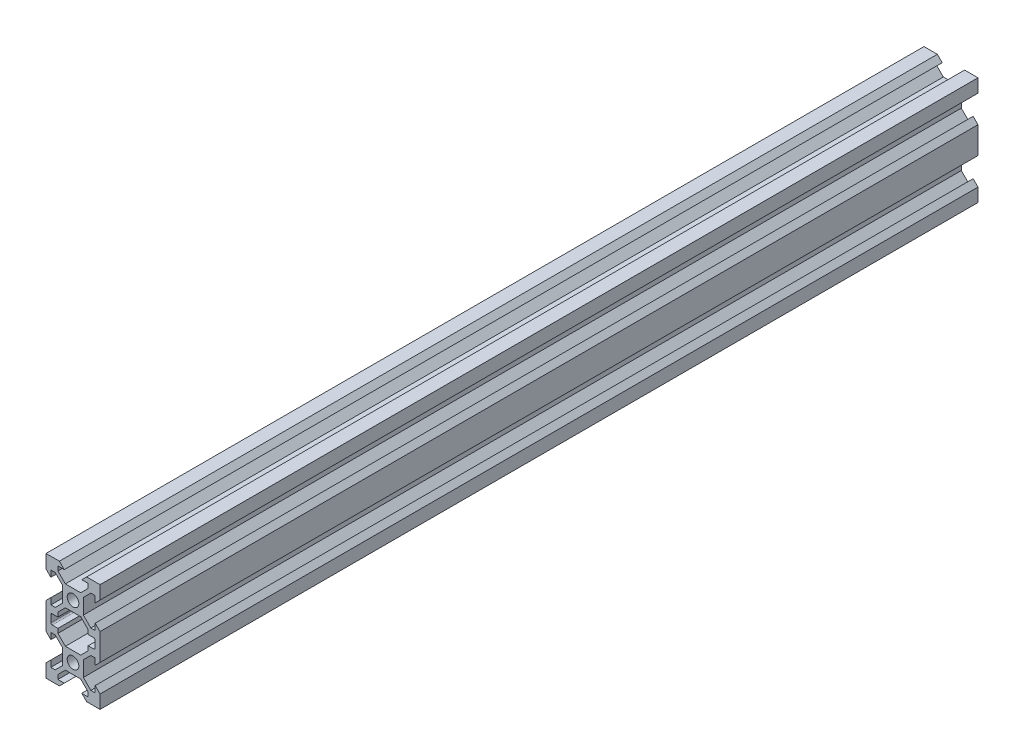
from build123d import *

# Parameters (mm, degrees)
CROQUIS1_R              = 2.15
SALIENTE_EXTRUIR1_DEPTH = 325


with BuildPart() as part:
    # Croquis1 → Saliente-Extruir1 (new body)
    with BuildSketch(Plane.XY):
        Polygon((20, 4.95), (18.2, 6.75), (18.2, 4.4), (16.589949494, 4.4), (13.825, 7.164949494), (13.825, 12.835050506), (16.589949494, 15.6), (18.2, 15.6), (18.2, 13.25), (20, 15.05), (20, 20), (15.05, 20), (13.25, 18.2), (15.6, 18.2), (15.6, 16.589949494), (12.835050506, 13.825), (7.164949494, 13.825), (4.4, 16.589949494), (4.4, 18.2), (6.75, 18.2), (4.95, 20), (0, 20), (0, 15.05), (1.8, 13.25), (1.8, 15.6), (3.410050506, 15.6), (6.175, 12.835050506), (6.175, 7.164949494), (3.410050506, 4.4), (1.8, 4.4), (1.8, 6.75), (0, 4.95), (0, -4.95), (1.8, -6.75), (1.8, -4.4), (3.410050506, -4.4), (6.175, -7.164949494), (6.175, -12.835050506), (3.410050506, -15.6), (1.8, -15.6), (1.8, -13.25), (0, -15.05), (0, -20), (4.95, -20), (6.75, -18.2), (4.4, -18.2), (4.4, -16.589949494), (7.164949494, -13.825), (12.835050506, -13.825), (15.6, -16.589949494), (15.6, -18.2), (13.25, -18.2), (15.05, -20), (20, -20), (20, -15.05), (18.2, -13.25), (18.2, -15.6), (16.589949494, -15.6), (13.825, -12.835050506), (13.825, -7.164949494), (16.589949494, -4.4), (18.2, -4.4), (18.2, -6.75), (20, -4.95), align=None)
        with BuildLine():
            Line((1.8, -1.3), (1.8, 1.3))
            ThreePointArc((1.8, 1.3), (1.946446609, 1.653553391), (2.3, 1.8))
            Line((2.3, 1.8), (4.4, 1.8))
            Line((4.4, 1.8), (4.4, 3.410050506))
            Line((4.4, 3.410050506), (7.164949494, 6.175))
            Line((7.164949494, 6.175), (12.835050506, 6.175))
            Line((12.835050506, 6.175), (15.6, 3.410050506))
            Line((15.6, 3.410050506), (15.6, 1.8))
            Line((15.6, 1.8), (17.7, 1.8))
            ThreePointArc((17.7, 1.8), (18.053553391, 1.653553391), (18.2, 1.3))
            Line((18.2, 1.3), (18.2, -1.3))
            ThreePointArc((18.2, -1.3), (18.053553391, -1.653553391), (17.7, -1.8))
            Line((17.7, -1.8), (15.6, -1.8))
            Line((15.6, -1.8), (15.6, -3.410050506))
            Line((15.6, -3.410050506), (12.835050506, -6.175))
            Line((12.835050506, -6.175), (7.164949494, -6.175))
            Line((7.164949494, -6.175), (4.4, -3.410050506))
            Line((4.4, -3.410050506), (4.4, -1.8))
            Line((4.4, -1.8), (2.3, -1.8))
            ThreePointArc((2.3, -1.8), (1.946446609, -1.653553391), (1.8, -1.3))
        make_face(mode=Mode.SUBTRACT)
        with Locations((10, -10)):
            Circle(CROQUIS1_R, mode=Mode.SUBTRACT)
        with Locations((10, 10)):
            Circle(CROQUIS1_R, mode=Mode.SUBTRACT)
    extrude(amount=SALIENTE_EXTRUIR1_DEPTH)


solid = part.part
